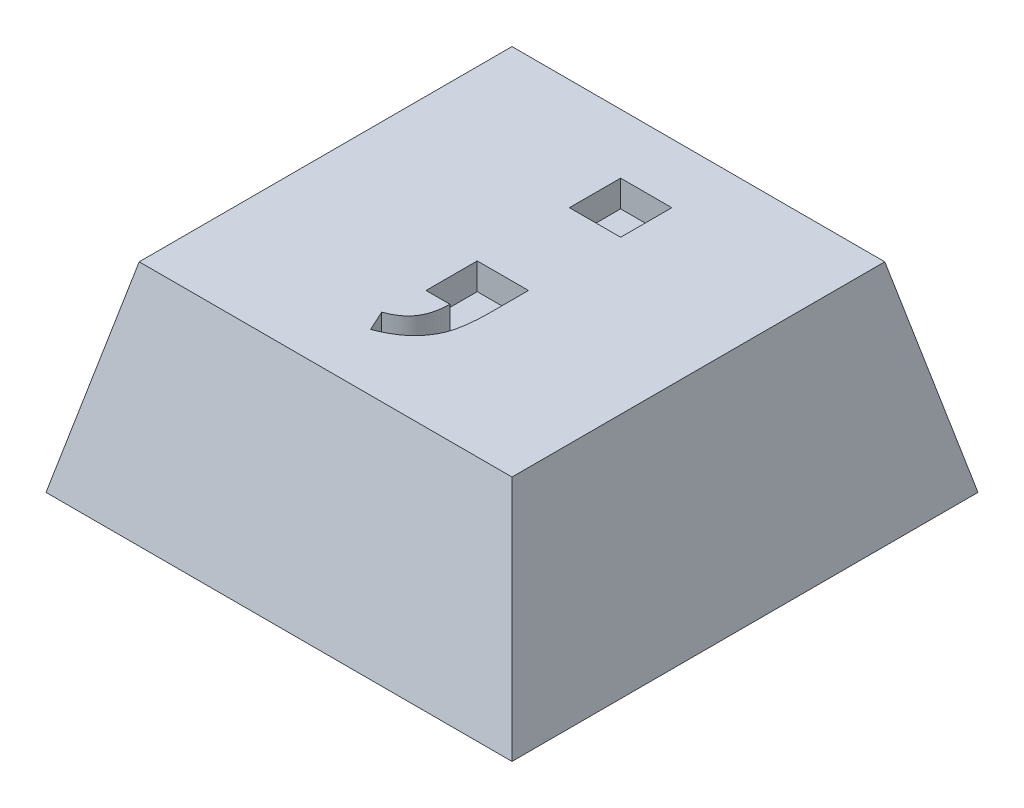
from build123d import *

# Parameters (mm, degrees)
SKETCH1_W           = 7
SKETCH1_H           = 7
BOSS_EXTRUDE1_DEPTH = 3
CUT_EXTRUDE1_DEPTH  = 7
CUT_EXTRUDE2_DEPTH  = 11
SKETCH4_R           = 1.8
CUT_EXTRUDE3_DEPTH  = 0.8
SKETCH5_W           = 0.769230769
SKETCH5_H           = 0.769230769
CUT_EXTRUDE4_DEPTH  = 0.4


with BuildPart() as part:
    # Sketch1 → Boss-Extrude1 (new body)
    with BuildSketch(Plane(origin=(0, 0, 0), x_dir=(1, 0, 0), z_dir=(0, 1, 0))):
        with Locations((3.5, 3.5)):
            Rectangle(SKETCH1_W, SKETCH1_H)
    extrude(amount=BOSS_EXTRUDE1_DEPTH)

    # Sketch2 → Cut-Extrude1 (cut)
    with BuildSketch(Plane.XY):
        Polygon((0, 0), (0.7, 3), (0, 3), align=None)
        Polygon((7, 0), (6.3, 3), (7, 3), align=None)
    extrude(amount=-CUT_EXTRUDE1_DEPTH, mode=Mode.SUBTRACT)

    # Sketch3 → Cut-Extrude2 (cut)
    with BuildSketch(Plane(origin=(0, 0, 0), x_dir=(0, 0, -1), z_dir=(1, 0, 0))):
        Polygon((0, 0), (0.7, 3), (0, 3), align=None)
        Polygon((7, 3), (6.3, 3), (7, 0), align=None)
    extrude(amount=CUT_EXTRUDE2_DEPTH, mode=Mode.SUBTRACT)

    # Sketch4 → Cut-Extrude3 (cut)
    with BuildSketch(Plane.XZ):
        with Locations(Location((3.5, -3.5, 0), (0, 0, 270))):
            Circle(SKETCH4_R)
    extrude(amount=-CUT_EXTRUDE3_DEPTH, mode=Mode.SUBTRACT)

    # Sketch5 → Cut-Extrude4 (cut)
    with BuildSketch(Plane(origin=(0, 3, 0), x_dir=(1, 0, 0), z_dir=(0, 1, 0))):
        with Locations((3.612093963, 5.019669427)):
            Rectangle(SKETCH5_W, SKETCH5_H)
        with BuildLine():
            Line((3.227478578, 3.250438657), (3.996709347, 3.250438657))
            Line((3.996709347, 3.250438657), (3.996709347, 2.691143785))
            add(Edge.make_bspline(
                [(3.996709347, 2.691143785), (3.996354449, 2.637428404), (3.995684356, 2.536006718), (3.983938379, 2.392937498), (3.967617452, 2.267298215), (3.941653281, 2.157473929), (3.906889784, 2.058293502), (3.857739809, 1.967540051), (3.797294746, 1.880692172), (3.723360469, 1.800377793), (3.638309276, 1.726095057), (3.541155635, 1.661498191), (3.434205152, 1.603945573), (3.357369532, 1.573646535), (3.31802345, 1.558130965)],
                knots=[0, 0, 0, 0, 1.347156832, 2.543608823, 3.599300285, 4.522475688, 5.370350604, 6.227678973, 7.103274953, 8.018757603, 8.959280198, 9.929437417, 10.939703653, 12, 12, 12, 12], degree=3))
            Line((3.31802345, 1.558130965), (3.176196527, 1.865823273))
            add(Edge.make_bspline(
                [(3.176196527, 1.865823273), (3.210545046, 1.879869864), (3.276215945, 1.906725527), (3.363744761, 1.959605892), (3.435078145, 2.021405192), (3.491618449, 2.092103782), (3.532319251, 2.173879945), (3.563358678, 2.265654966), (3.580969568, 2.369726497), (3.584571264, 2.442951924), (3.586452937, 2.481207888)],
                knots=[0, 0, 0, 0, 1.115416734, 2.132564161, 3.06091458, 3.941973359, 4.836922823, 5.794989041, 6.848011894, 8, 8, 8, 8], degree=3))
            Line((3.586452937, 2.481207888), (3.227478578, 2.481207888))
            Line((3.227478578, 2.481207888), (3.227478578, 3.250438657))
        make_face()
    extrude(amount=-CUT_EXTRUDE4_DEPTH, mode=Mode.SUBTRACT)


solid = part.part
